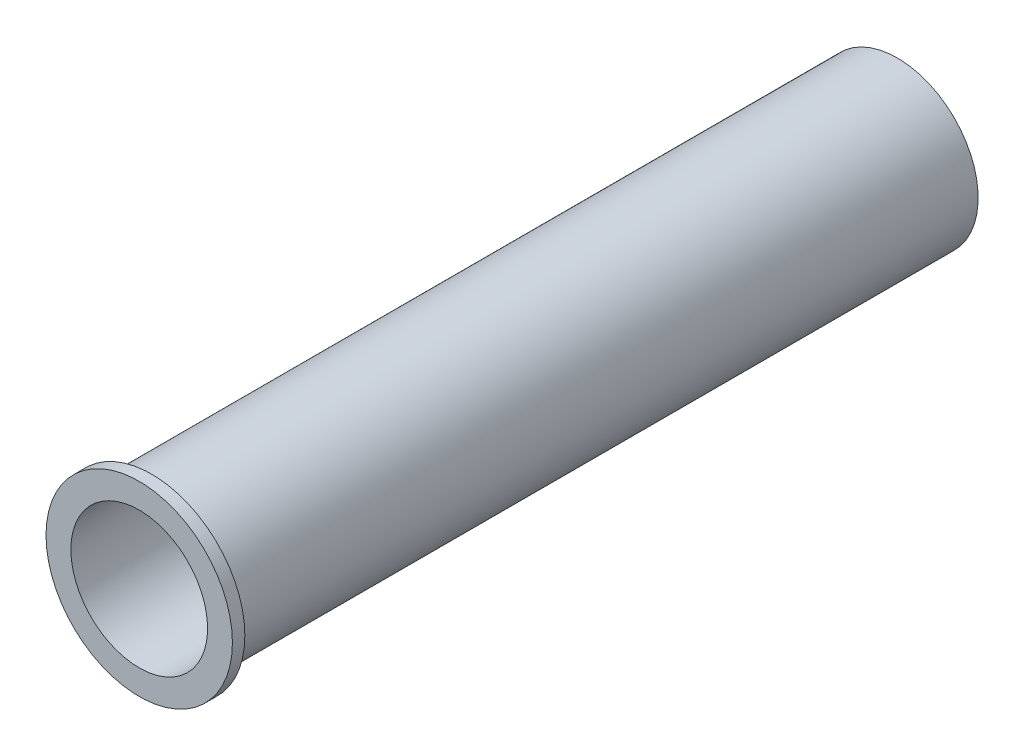
from build123d import *


with BuildPart() as part:
    # Croquis1 → Revolución1 (revolve)
    with BuildSketch(Plane.YZ, mode=Mode.PRIVATE) as revoluci_n1_sk:
        Polygon((11, -60), (11, 60), (15, 60), (15, 58), (13, 58), (13, -62), (9.5, -62), (9.5, -60), align=None)
    revolve(revoluci_n1_sk.sketch.rotate(Axis((0, 0, 0), (0, 0, 1)), 90), axis=Axis((0, 0, 0), (0, 0, 1)))


solid = part.part
